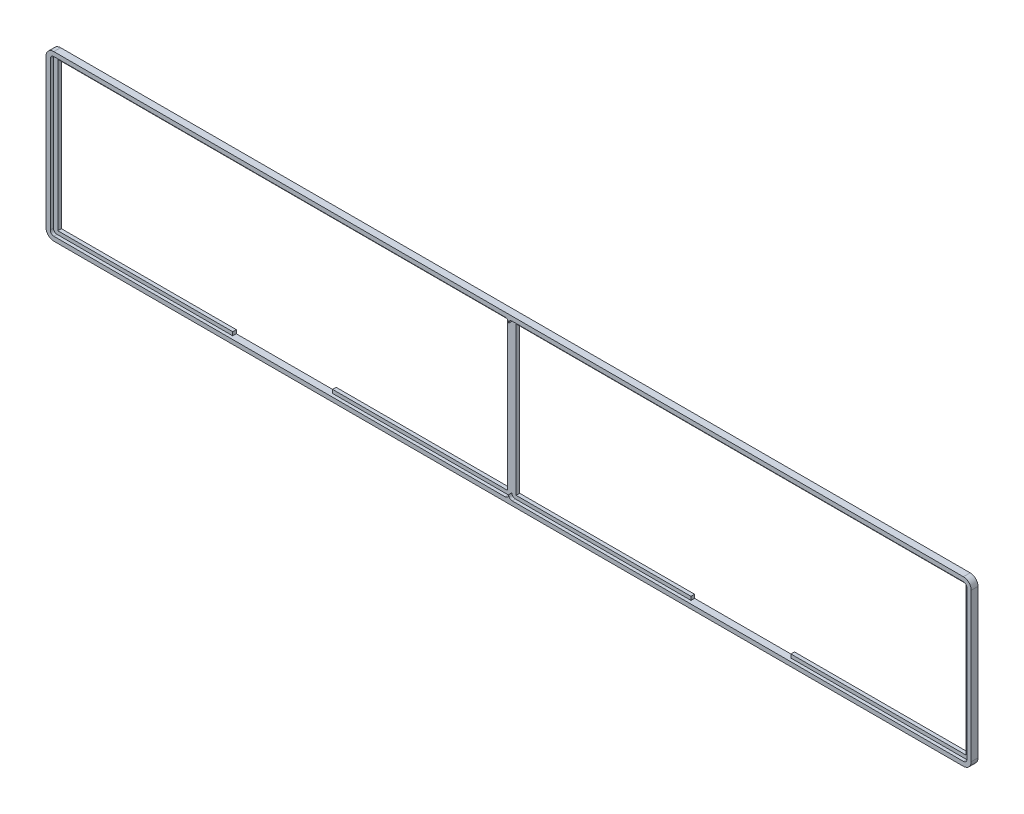
from build123d import *

# Parameters (mm, degrees)
BOSS_EXTRUDE1_DEPTH = 2.25
BOSS_EXTRUDE2_DEPTH = 2.5


with BuildPart() as part:
    # Sketch1 → Boss-Extrude1 (new body)
    with BuildSketch(Plane.XY.offset(30)):
        with BuildLine():
            Line((-291, 3.75), (-291, -100.25))
            ThreePointArc((-291, -100.25), (-289.389087297, -104.139087297), (-285.5, -105.75))
            Line((-285.5, -105.75), (30.5, -105.75))
            Line((30.5, -105.75), (35.5, -105.75))
            Line((35.5, -105.75), (351.5, -105.75))
            ThreePointArc((351.5, -105.75), (355.389087297, -104.139087297), (357, -100.25))
            Line((357, -100.25), (357, 3.75))
            ThreePointArc((357, 3.75), (355.389087297, 7.639087297), (351.5, 9.25))
            Line((351.5, 9.25), (35.5, 9.25))
            Line((35.5, 9.25), (30.5, 9.25))
            Line((30.5, 9.25), (-285.5, 9.25))
            ThreePointArc((-285.5, 9.25), (-289.389087297, 7.639087297), (-291, 3.75))
        make_face()
        with BuildLine():
            Line((30.5, 6.25), (-285.5, 6.25))
            ThreePointArc((-285.5, 6.25), (-287.267766953, 5.517766953), (-288, 3.75))
            Line((-288, 3.75), (-288, -100.25))
            ThreePointArc((-288, -100.25), (-287.267766953, -102.017766953), (-285.5, -102.75))
            Line((-285.5, -102.75), (30.5, -102.75))
            ThreePointArc((30.5, -102.75), (32.267766953, -102.017766953), (33, -100.25))
            ThreePointArc((33, -100.25), (33.732233047, -102.017766953), (35.5, -102.75))
            Line((35.5, -102.75), (351.5, -102.75))
            ThreePointArc((351.5, -102.75), (353.267766953, -102.017766953), (354, -100.25))
            Line((354, -100.25), (354, 3.75))
            ThreePointArc((354, 3.75), (353.267766953, 5.517766953), (351.5, 6.25))
            Line((351.5, 6.25), (35.5, 6.25))
            ThreePointArc((35.5, 6.25), (33.732233047, 5.517766953), (33, 3.75))
            ThreePointArc((33, 3.75), (32.267766953, 5.517766953), (30.5, 6.25))
        make_face(mode=Mode.SUBTRACT)
    extrude(amount=-BOSS_EXTRUDE1_DEPTH)

    # Sketch2 → Boss-Extrude2 (add)
    # profile 1 of 2: a face of its own
    with BuildSketch(Plane(origin=(0, 0, 27.75), x_dir=(-1, 0, 0), z_dir=(0, 0, -1))):
        with BuildLine():
            Line((291, -100.25), (291, 3.75))
            ThreePointArc((291, 3.75), (289.389087297, 7.639087297), (285.5, 9.25))
            Line((285.5, 9.25), (-351.5, 9.25))
            ThreePointArc((-351.5, 9.25), (-355.389087297, 7.639087297), (-357, 3.75))
            Line((-357, 3.75), (-357, -100.25))
            ThreePointArc((-357, -100.25), (-355.389087297, -104.139087297), (-351.5, -105.75))
            Line((-351.5, -105.75), (285.5, -105.75))
            ThreePointArc((285.5, -105.75), (289.389087297, -104.139087297), (291, -100.25))
        make_face()
        with BuildLine():
            ThreePointArc((288, -100.25), (287.267766953, -102.017766953), (285.5, -102.75))
            Line((285.5, -102.75), (-30.5, -102.75))
            ThreePointArc((-30.5, -102.75), (-32.267766953, -102.017766953), (-33, -100.25))
            ThreePointArc((-33, -100.25), (-33.732233047, -102.017766953), (-35.5, -102.75))
            Line((-35.5, -102.75), (-351.5, -102.75))
            ThreePointArc((-351.5, -102.75), (-353.267766953, -102.017766953), (-354, -100.25))
            Line((-354, -100.25), (-354, 3.75))
            ThreePointArc((-354, 3.75), (-353.267766953, 5.517766953), (-351.5, 6.25))
            Line((-351.5, 6.25), (-35.5, 6.25))
            ThreePointArc((-35.5, 6.25), (-33.732233047, 5.517766953), (-33, 3.75))
            ThreePointArc((-33, 3.75), (-32.267766953, 5.517766953), (-30.5, 6.25))
            Line((-30.5, 6.25), (285.5, 6.25))
            ThreePointArc((285.5, 6.25), (287.267766953, 5.517766953), (288, 3.75))
            Line((288, 3.75), (288, -100.25))
        make_face(mode=Mode.SUBTRACT)
    # profile 2 of 2: a face of its own
    with BuildSketch(Plane(origin=(0, 0, 27.75), x_dir=(-1, 0, 0), z_dir=(0, 0, -1))):
        with BuildLine():
            Line((-351, 3.75), (-36, 3.75))
            Line((-36, 3.75), (-36, -100.25))
            Line((-36, -100.25), (-158.5, -100.25))
            Line((-158.5, -100.25), (-158.5, -102.75))
            Line((-158.5, -102.75), (-35.5, -102.75))
            ThreePointArc((-35.5, -102.75), (-33.732233047, -102.017766953), (-33, -100.25))
            ThreePointArc((-33, -100.25), (-32.267766953, -102.017766953), (-30.5, -102.75))
            Line((-30.5, -102.75), (92.5, -102.75))
            Line((92.5, -102.75), (92.5, -100.25))
            Line((92.5, -100.25), (-30, -100.25))
            Line((-30, -100.25), (-30, 3.75))
            Line((-30, 3.75), (285, 3.75))
            Line((285, 3.75), (285, -100.25))
            Line((285, -100.25), (162.5, -100.25))
            Line((162.5, -100.25), (162.5, -102.75))
            Line((162.5, -102.75), (285.5, -102.75))
            ThreePointArc((285.5, -102.75), (287.267766953, -102.017766953), (288, -100.25))
            Line((288, -100.25), (288, 3.75))
            ThreePointArc((288, 3.75), (287.267766953, 5.517766953), (285.5, 6.25))
            Line((285.5, 6.25), (-30.5, 6.25))
            ThreePointArc((-30.5, 6.25), (-32.267766953, 5.517766953), (-33, 3.75))
            ThreePointArc((-33, 3.75), (-33.732233047, 5.517766953), (-35.5, 6.25))
            Line((-35.5, 6.25), (-351.5, 6.25))
            ThreePointArc((-351.5, 6.25), (-353.267766953, 5.517766953), (-354, 3.75))
            Line((-354, 3.75), (-354, -100.25))
            ThreePointArc((-354, -100.25), (-353.267766953, -102.017766953), (-351.5, -102.75))
            Line((-351.5, -102.75), (-228.5, -102.75))
            Line((-228.5, -102.75), (-228.5, -100.25))
            Line((-228.5, -100.25), (-351, -100.25))
            Line((-351, -100.25), (-351, 3.75))
        make_face()
    extrude(amount=BOSS_EXTRUDE2_DEPTH)


solid = part.part
